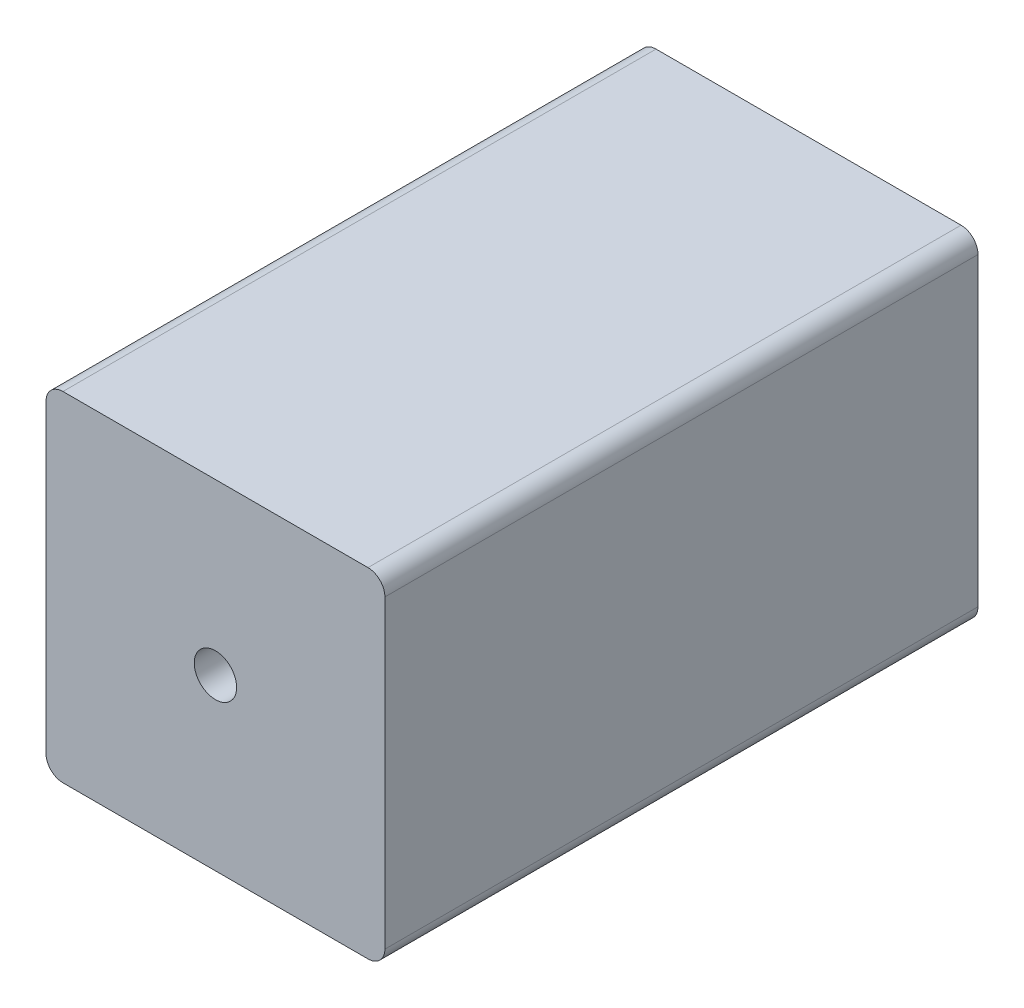
from build123d import *

# Parameters (mm, degrees)
SKETCH1_W           = 40
SKETCH1_H           = 40
SKETCH1_R           = 2.5
BOSS_EXTRUDE1_DEPTH = 35
FILLET1_R           = 2


with BuildPart() as part:
    # Sketch1 → Boss-Extrude1 (new, symmetric)
    with BuildSketch(Plane.XY):
        Rectangle(SKETCH1_W, SKETCH1_H)
        Circle(SKETCH1_R, mode=Mode.SUBTRACT)
    extrude(amount=BOSS_EXTRUDE1_DEPTH, both=True)

    # Fillet1
    fillet1_edges = [part.edges().sort_by_distance(p)[0] for p in [
        (20, -20, 0),
        (-20, -20, 0),
        (-20, 20, 0),
        (20, 20, 0),
    ]]
    fillet(fillet1_edges, radius=FILLET1_R)


solid = part.part
